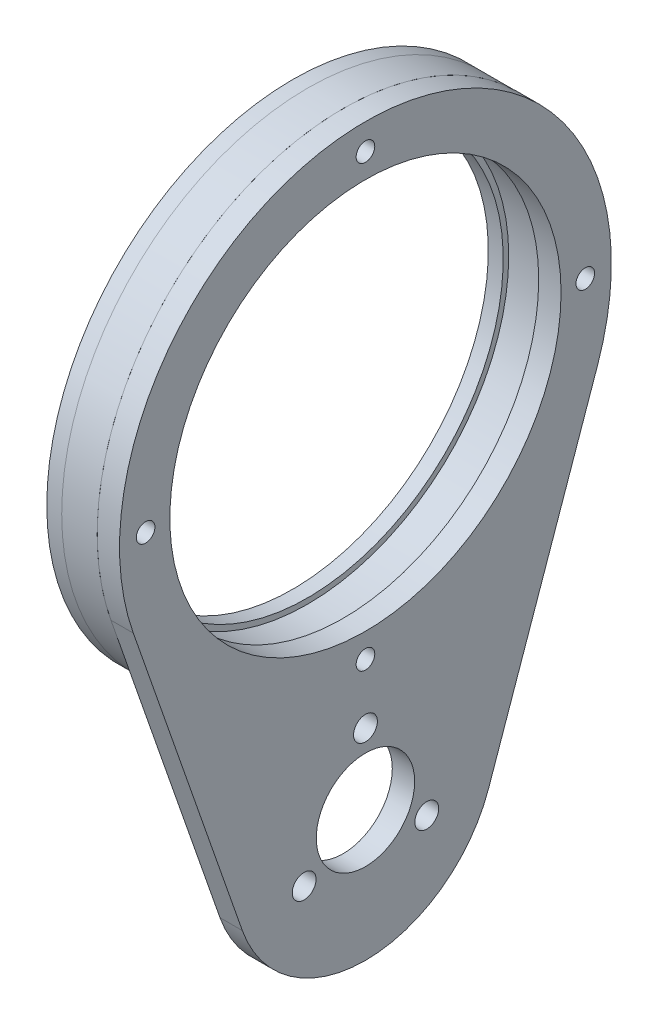
from build123d import *

# Parameters (mm, degrees)
SKETCH_2_R      = 6.6
SKETCH_2_R_2    = 1.6
SKETCH_2_R_3    = 26.25
SKETCH_2_R_4    = 1.25
EXTRUDE_1_DEPTH = 3
SKETCH_6_R      = 33
SKETCH_6_R_2    = 26.9875
SKETCH_6_R_3    = 1.6
EXTRUDE_4_DEPTH = 4.763
SKETCH_7_R      = 33
SKETCH_7_R_2    = 26.25
SKETCH_7_R_3    = 1.6
EXTRUDE_5_DEPTH = 2


with BuildPart() as part:
    # ｽｹｯﾁ2 → ﾎﾞｽ - 押し出し1 (new body)
    with BuildSketch(Plane(origin=(0, 0, 0), x_dir=(0, 0, -1), z_dir=(1, 0, 0))):
        with BuildLine():
            Line((-31.15382439, 36.117021277), (-16.520967479, -5.771276596))
            ThreePointArc((-16.520967479, -5.771276596), (0, -17.5), (16.520967479, -5.771276596))
            Line((16.520967479, -5.771276596), (31.15382439, 36.117021277))
            ThreePointArc((31.15382439, 36.117021277), (0, 80), (-31.15382439, 36.117021277))
        make_face()
        Circle(SKETCH_2_R, mode=Mode.SUBTRACT)
        with Locations((0, 9.5)):
            Circle(SKETCH_2_R_2, mode=Mode.SUBTRACT)
        with Locations((8.227241336, -4.75)):
            Circle(SKETCH_2_R_2, mode=Mode.SUBTRACT)
        with Locations((-8.227241336, -4.75)):
            Circle(SKETCH_2_R_2, mode=Mode.SUBTRACT)
        with Locations((0, 47)):
            Circle(SKETCH_2_R_3, mode=Mode.SUBTRACT)
        with Locations((0, 76.5)):
            Circle(SKETCH_2_R_4, mode=Mode.SUBTRACT)
        with Locations((0, 17.5)):
            Circle(SKETCH_2_R_4, mode=Mode.SUBTRACT)
        with Locations((29.5, 47)):
            Circle(SKETCH_2_R_4, mode=Mode.SUBTRACT)
        with Locations((-29.5, 47)):
            Circle(SKETCH_2_R_4, mode=Mode.SUBTRACT)
    extrude(amount=EXTRUDE_1_DEPTH)


with BuildPart() as body_2:
    # ｽｹｯﾁ6 → ﾎﾞｽ - 押し出し4 (new body)
    with BuildSketch(Plane.ZY):
        with Locations((0, 47)):
            Circle(SKETCH_6_R)
        with Locations((0, 47)):
            Circle(SKETCH_6_R_2, mode=Mode.SUBTRACT)
        with Locations((0, 76.5)):
            Circle(SKETCH_6_R_3, mode=Mode.SUBTRACT)
        with Locations((29.5, 47)):
            Circle(SKETCH_6_R_3, mode=Mode.SUBTRACT)
        with Locations((0, 17.5)):
            Circle(SKETCH_6_R_3, mode=Mode.SUBTRACT)
        with Locations((-29.5, 47)):
            Circle(SKETCH_6_R_3, mode=Mode.SUBTRACT)
    extrude(amount=EXTRUDE_4_DEPTH)


with BuildPart() as body_3:
    # ｽｹｯﾁ7 → ﾎﾞｽ - 押し出し5 (new body)
    with BuildSketch(Plane.ZY.offset(4.763)):
        with Locations((0, 47)):
            Circle(SKETCH_7_R)
        with Locations((0, 47)):
            Circle(SKETCH_7_R_2, mode=Mode.SUBTRACT)
        with Locations((0, 17.5)):
            Circle(SKETCH_7_R_3, mode=Mode.SUBTRACT)
        with Locations((29.5, 47)):
            Circle(SKETCH_7_R_3, mode=Mode.SUBTRACT)
        with Locations((-29.5, 47)):
            Circle(SKETCH_7_R_3, mode=Mode.SUBTRACT)
        with Locations((0, 76.5)):
            Circle(SKETCH_7_R_3, mode=Mode.SUBTRACT)
    extrude(amount=EXTRUDE_5_DEPTH)


solid = Compound([part.part, body_2.part, body_3.part])
